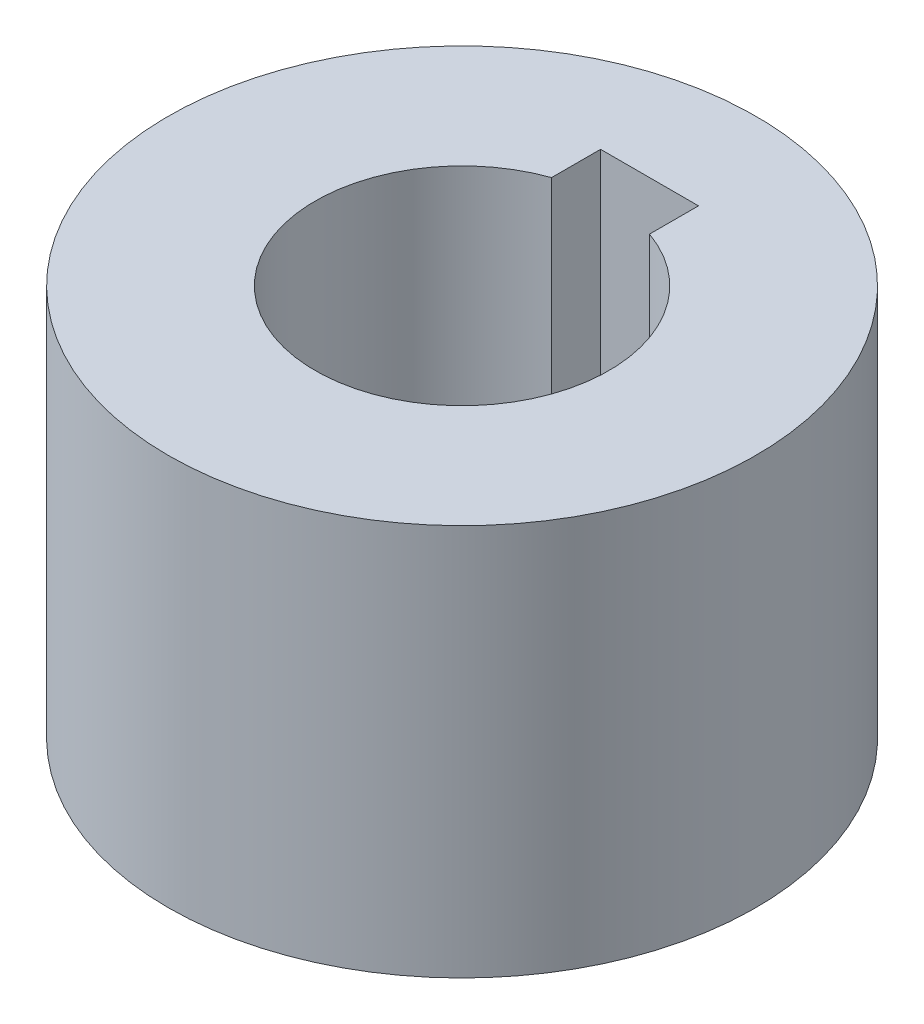
from build123d import *

# Parameters (mm, degrees)
SKETCH1_R           = 15
BOSS_EXTRUDE1_DEPTH = 20


with BuildPart() as part:
    # Sketch1 → Boss-Extrude1 (new body)
    with BuildSketch(Plane(origin=(0, 0, 0), x_dir=(1, 0, 0), z_dir=(0, 1, 0))):
        with Locations(Location((0, 0, 0), (0, 0, 270))):
            Circle(SKETCH1_R)
        with BuildLine():
            Line((2.5, 7.071067812), (2.5, 9.571067812))
            Line((2.5, 9.571067812), (-2.5, 9.571067812))
            Line((-2.5, 9.571067812), (-2.5, 7.071067812))
            ThreePointArc((-2.5, 7.071067812), (0, -7.5), (2.5, 7.071067812))
        make_face(mode=Mode.SUBTRACT)
    extrude(amount=BOSS_EXTRUDE1_DEPTH)


solid = part.part
